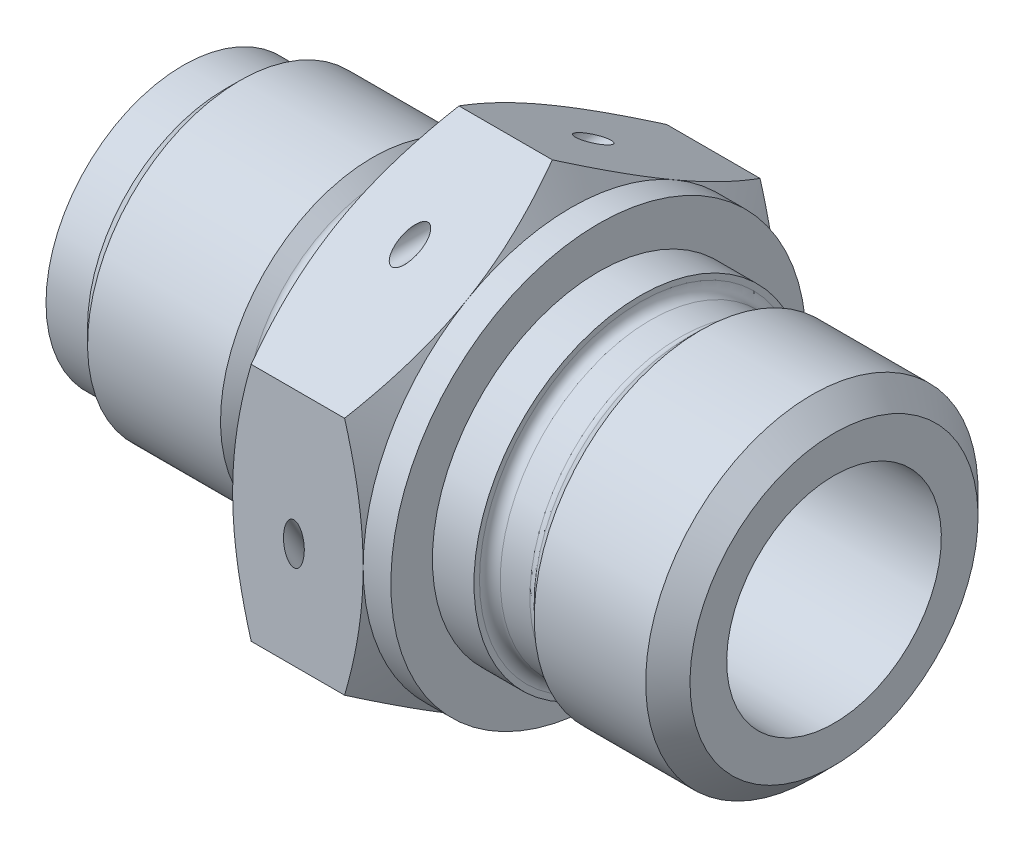
from build123d import *

# Parameters (mm, degrees)
SKETCH_2_OUTSIDE_W       = 57.1
SKETCH_2_OUTSIDE_H       = 57.1
CUT_EXTRUDE_1_DEPTH      = 41.509258201
SKETCH_3_OUTSIDE_W       = 182.566
SKETCH_3_OUTSIDE_H       = 187.208
SKETCH_3_OUTSIDE_R       = 15
CUT_EXTRUDE_2_DEPTH      = 39.548670535
CUT_EXTRUDE_2_DRAFT      = -60
SKETCH_4_OUTSIDE_W       = 177.06
SKETCH_4_OUTSIDE_H       = 181.702
SKETCH_4_OUTSIDE_R       = 14
CUT_EXTRUDE_3_DEPTH      = 37.959437225
CUT_EXTRUDE_3_DRAFT      = -60
SKETCH_5_R               = 0.75
CUT_EXTRUDE_4_DEPTH      = 56
PATTERN_CIRCULAR_1_COUNT = 3


with BuildPart() as part:
    # Эскиз1 → Повернуть1 (revolve)
    with BuildSketch(Plane.XY):
        with BuildLine():
            Line((0, 7.75), (-19.3, 7.75))
            Line((-19.3, 7.75), (-19.3, 3))
            Line((-19.3, 3), (-50, 3))
            Line((-50, 3), (-50, 4.75))
            Line((-50, 4.75), (-49.75, 5))
            Line((-49.75, 5), (-47, 5))
            Line((-47, 5), (-47, 9.9))
            Line((-47, 9.9), (-44, 9.9))
            Line((-44, 9.9), (-42.9, 11))
            Line((-42.9, 11), (-33.3, 11))
            Line((-33.3, 11), (-32.419669914, 10.119669914))
            ThreePointArc((-32.419669914, 10.119669914), (-32.176352402, 9.957090351), (-31.889339828, 9.9))
            Line((-31.889339828, 9.9), (-29.75, 9.9))
            ThreePointArc((-29.75, 9.9), (-29.219669914, 10.119669914), (-29, 10.65))
            Line((-29, 10.65), (-29, 20))
            Line((-29, 20), (-19, 20))
            Line((-19, 20), (-19, 15))
            Line((-19, 15), (-17, 15))
            Line((-17, 15), (-17, 12))
            Line((-17, 12), (-14, 12))
            Line((-14, 12), (-14, 11.6))
            ThreePointArc((-14, 11.6), (-13.780330086, 11.069669914), (-13.25, 10.85))
            Line((-13.25, 10.85), (-11.110660172, 10.85))
            ThreePointArc((-11.110660172, 10.85), (-10.823647598, 10.907090351), (-10.580330086, 11.069669914))
            Line((-10.580330086, 11.069669914), (-9.65, 12))
            Line((-9.65, 12), (-1.6, 12))
            Line((-1.6, 12), (0, 10.4))
            Line((0, 10.4), (0, 7.75))
        make_face()
    revolve(axis=Axis((0, 0, 0), (-1, 0, 0)))

    # Эскиз2 outside → Вырез-Вытянуть1 (cut, through all)
    with BuildSketch(Plane.ZY.offset(29)):
        Rectangle(SKETCH_2_OUTSIDE_W, SKETCH_2_OUTSIDE_H)
        Polygon((0, 17.320508076), (-15, 8.660254038), (-15, -8.660254038), (0, -17.320508076), (15, -8.660254038), (15, 8.660254038), align=None, mode=Mode.SUBTRACT)
    extrude(amount=-CUT_EXTRUDE_1_DEPTH, mode=Mode.SUBTRACT)


with BuildPart() as cut_extrude_2_tool:
    # Эскиз3 outside → Вырез-Вытянуть2 (with draft: the straight prism first)
    with BuildSketch(Plane(origin=(-19, 0, 0), x_dir=(0, 0, -1), z_dir=(1, 0, 0))):
        Rectangle(SKETCH_3_OUTSIDE_W, SKETCH_3_OUTSIDE_H)
        with Locations(Location((0, 0, 0), (0, 0, 90))):
            Circle(SKETCH_3_OUTSIDE_R, mode=Mode.SUBTRACT)
    extrude(amount=-CUT_EXTRUDE_2_DEPTH)
    # Вырез-Вытянуть2: the draft: its side faces are tilted about the plane it starts from
    cut_extrude_2_sides = [cut_extrude_2_tool.faces().sort_by_distance(p)[0] for p in [
        (-38.774335267, -93.604, 0),
        (-38.774335267, 0, -91.283),
        (-38.774335267, 93.604, 0),
        (-38.774335267, 0, 91.283),
        (-38.774335267, -15, 0),
    ]]
    draft(cut_extrude_2_sides, Plane(origin=(-19, 0, 0), x_dir=(0, 0, -1), z_dir=(1, 0, 0)), CUT_EXTRUDE_2_DRAFT)


with BuildPart() as part_1:
    add(part.part)

    # Вырез-Вытянуть2: cut by cut_extrude_2_tool
    add(cut_extrude_2_tool.part, mode=Mode.SUBTRACT)


with BuildPart() as cut_extrude_3_tool:
    # Эскиз4 outside → Вырез-Вытянуть3 (with draft: the straight prism first)
    with BuildSketch(Plane.ZY.offset(29)):
        Rectangle(SKETCH_4_OUTSIDE_W, SKETCH_4_OUTSIDE_H)
        Circle(SKETCH_4_OUTSIDE_R, mode=Mode.SUBTRACT)
    extrude(amount=-CUT_EXTRUDE_3_DEPTH)
    # Вырез-Вытянуть3: the draft: its side faces are tilted about the plane it starts from
    cut_extrude_3_sides = [cut_extrude_3_tool.faces().sort_by_distance(p)[0] for p in [
        (-10.020281387, -90.851, 0),
        (-10.020281387, 0, 88.53),
        (-10.020281387, 90.851, 0),
        (-10.020281387, 0, -88.53),
        (-10.020281387, 0, -14),
    ]]
    draft(cut_extrude_3_sides, Plane.ZY.offset(29), CUT_EXTRUDE_3_DRAFT)


with BuildPart() as part_2:
    add(part_1.part)

    # Вырез-Вытянуть3: cut by cut_extrude_3_tool
    add(cut_extrude_3_tool.part, mode=Mode.SUBTRACT)

    # Эскиз5 → Вырез-Вытянуть4 (cut, symmetric)
    with BuildSketch(Plane.XY):
        with Locations(Location((-24, 13.5, 0), (0, 0, 270))):
            Circle(SKETCH_5_R)
    cut_extrude_4 = extrude(amount=CUT_EXTRUDE_4_DEPTH, both=True, mode=Mode.SUBTRACT)

    # Круговой массив1: Вырез-Вытянуть4 ×3 about axis
    pattern_circular_1_axis = Axis((0, 0, 0), (1, 0, 0))
    for i in range(1, PATTERN_CIRCULAR_1_COUNT):
        add(cut_extrude_4.rotate(pattern_circular_1_axis, i * 360 / PATTERN_CIRCULAR_1_COUNT), mode=Mode.SUBTRACT)


solid = part_2.part
